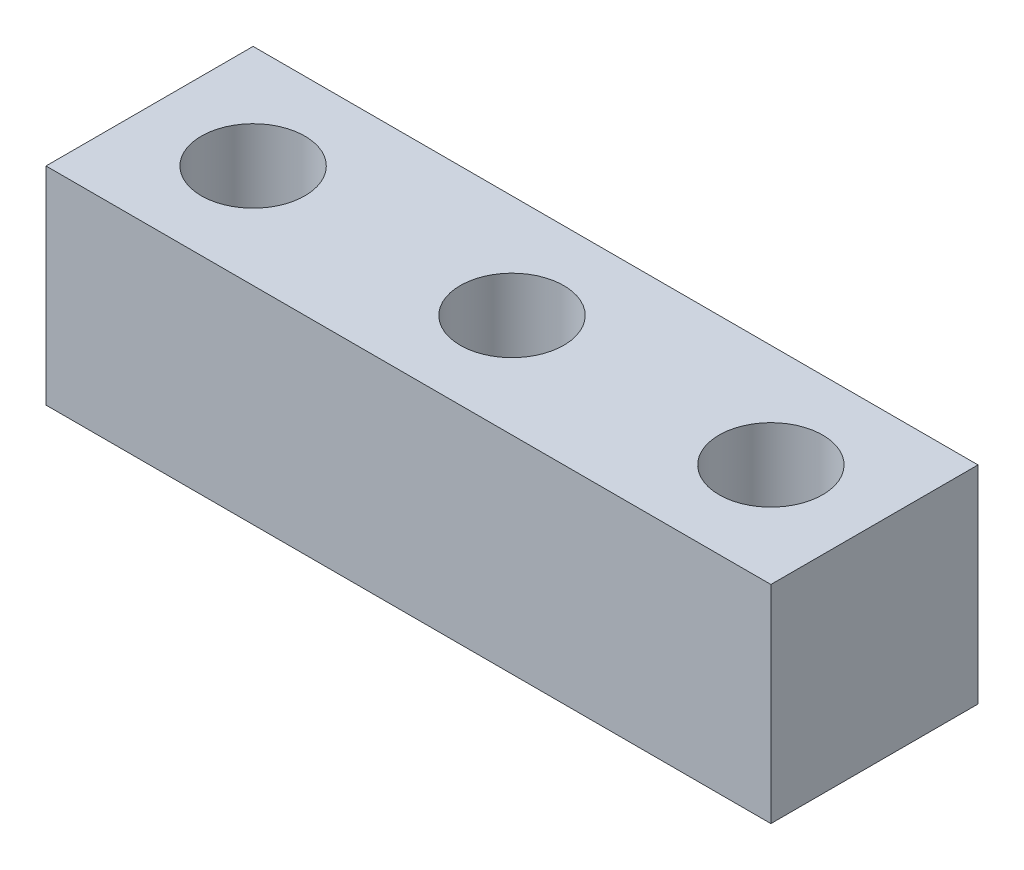
from build123d import *

# Parameters (mm, degrees)
SKETCH1_W           = 44.45
SKETCH1_H           = 12.7
SKETCH1_R           = 3.175
BOSS_EXTRUDE1_DEPTH = 12.7


with BuildPart() as part:
    # Sketch1 → Boss-Extrude1 (new body)
    with BuildSketch(Plane(origin=(0, 0, 0), x_dir=(1, 0, 0), z_dir=(0, 1, 0))):
        Rectangle(SKETCH1_W, SKETCH1_H)
        with Locations(Location((-15.875, 0, 0), (0, 0, 270))):
            Circle(SKETCH1_R, mode=Mode.SUBTRACT)
        with Locations(Location((15.875, 0, 0), (0, 0, 270))):
            Circle(SKETCH1_R, mode=Mode.SUBTRACT)
        with Locations(Location((0, 0, 0), (0, 0, 270))):
            Circle(SKETCH1_R, mode=Mode.SUBTRACT)
    extrude(amount=BOSS_EXTRUDE1_DEPTH)


solid = part.part
